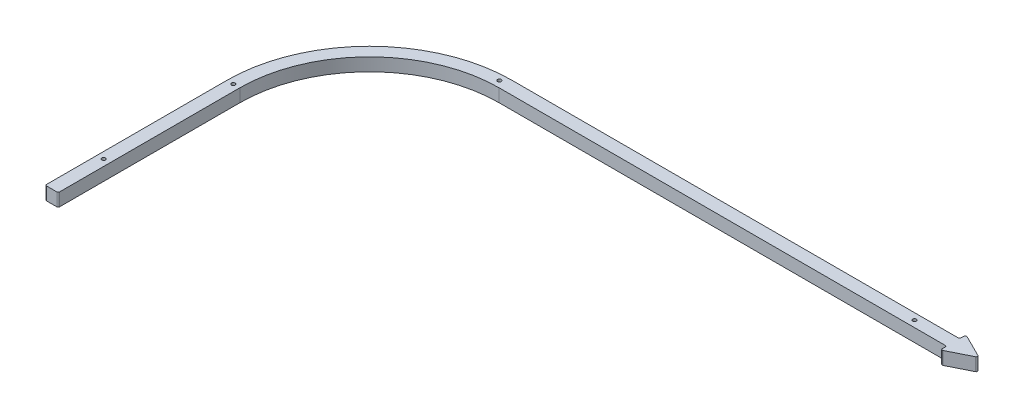
from build123d import *

# Parameters (mm, degrees)
SKETCH1_W               = 6.35
SKETCH1_H               = 88.9
SKETCH1_W_2             = 231.775
SKETCH1_H_2             = 6.35
SKETCH1_W_3             = 12.7
SKETCH1_H_3             = 12.7
BOSS_EXTRUDE1_DEPTH     = 6.35
CUT_EXTRUDE1_DEPTH      = 343.399866749
CUT_EXTRUDE1_DEPTH_BACK = 343.399866749
FILLET1_R               = 0.635
SKETCH3_R               = 0.889
CUT_EXTRUDE2_DEPTH      = 342.522840468


with BuildPart() as part:
    # Sketch1 → Boss-Extrude1 (new body)
    with BuildSketch(Plane(origin=(0, 0, 0), x_dir=(1, 0, 0), z_dir=(0, 1, 0))):
        with Locations((3.175, 44.45)):
            Rectangle(SKETCH1_W, SKETCH1_H)
        with BuildLine():
            ThreePointArc((0, 88.9), (20.458591334, 138.291408666), (69.85, 158.75))
            Line((69.85, 158.75), (69.85, 152.4))
            ThreePointArc((69.85, 152.4), (24.948719395, 133.801280605), (6.35, 88.9))
            Line((6.35, 88.9), (0, 88.9))
        make_face()
        with Locations((185.7375, 155.575)):
            Rectangle(SKETCH1_W_2, SKETCH1_H_2)
        with Locations((295.275, 155.575)):
            Rectangle(SKETCH1_W_3, SKETCH1_H_3)
    extrude(amount=BOSS_EXTRUDE1_DEPTH)

    # Sketch2 → Cut-Extrude1 (cut, two sides: drawn at the far end of the back side and taken through both)
    with BuildSketch(Plane(origin=(0, 6.35, 0), x_dir=(1, 0, 0), z_dir=(0, 1, 0)).offset(-CUT_EXTRUDE1_DEPTH_BACK)):
        Polygon((301.625, 161.925), (288.925, 161.925), (301.625, 155.575), align=None)
        Polygon((301.625, 149.225), (301.625, 155.575), (288.925, 149.225), align=None)
    extrude(amount=CUT_EXTRUDE1_DEPTH + CUT_EXTRUDE1_DEPTH_BACK, mode=Mode.SUBTRACT)

    # Fillet1
    fillet1_edges = [part.edges().sort_by_distance(p)[0] for p in [
        (0, 3.175, 0),
        (288.925, 3.175, -158.75),
        (288.925, 3.175, -152.4),
        (6.35, 3.175, 0),
        (288.925, 3.175, -161.925),
        (288.925, 3.175, -149.225),
        (301.625, 3.175, -155.575),
    ]]
    fillet(fillet1_edges, radius=FILLET1_R)

    # Sketch3 → Cut-Extrude2 (cut, through all)
    with BuildSketch(Plane(origin=(0, 6.35, 0), x_dir=(1, 0, 0), z_dir=(0, 1, 0))):
        with Locations(Location((3.175, 25.4, 0), (0, 0, 270))):
            Circle(SKETCH3_R)
        with Locations(Location((3.175, 88.9, 0), (0, 0, 270))):
            Circle(SKETCH3_R)
        with Locations(Location((66.802, 155.575, 0), (0, 0, 270))):
            Circle(SKETCH3_R)
        with Locations(Location((270.002, 155.575, 0), (0, 0, 270))):
            Circle(SKETCH3_R)
    extrude(amount=-CUT_EXTRUDE2_DEPTH, mode=Mode.SUBTRACT)


solid = part.part
